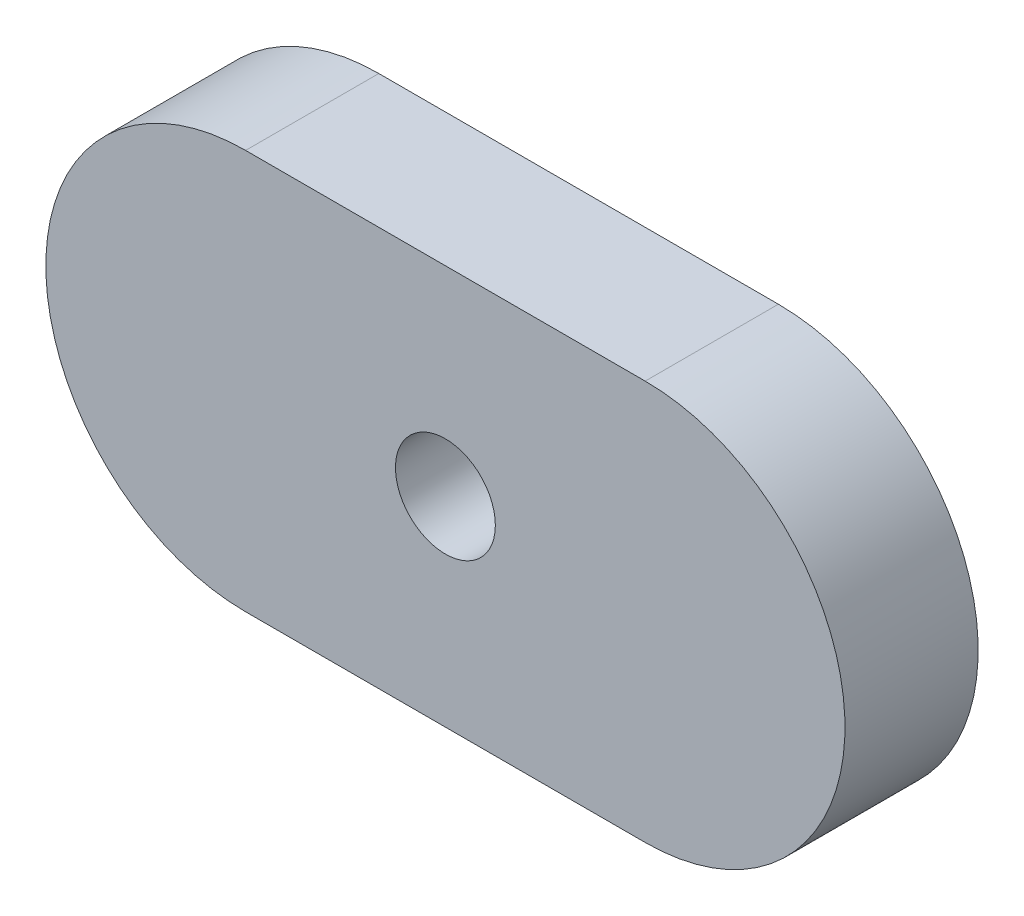
from build123d import *

# Parameters (mm, degrees)
BOSS_EXTRUDE1_DEPTH = 0.508
SKETCH2_R           = 0.1905
CUT_EXTRUDE1_DEPTH  = 0.508


with BuildPart() as part:
    # Sketch1 → Boss-Extrude1 (new body)
    with BuildSketch(Plane.XY):
        with BuildLine():
            Line((0, -0.762), (-1.524, -0.762))
            ThreePointArc((-1.524, -0.762), (-2.286, 0), (-1.524, 0.762))
            Line((-1.524, 0.762), (0, 0.762))
            ThreePointArc((0, 0.762), (0.762, 0), (0, -0.762))
        make_face()
    extrude(amount=BOSS_EXTRUDE1_DEPTH)

    # Sketch2 → Cut-Extrude1 (cut)
    with BuildSketch(Plane.XY.offset(0.508)):
        with Locations((-0.762, 0)):
            Circle(SKETCH2_R)
    extrude(amount=-CUT_EXTRUDE1_DEPTH, mode=Mode.SUBTRACT)


solid = part.part
